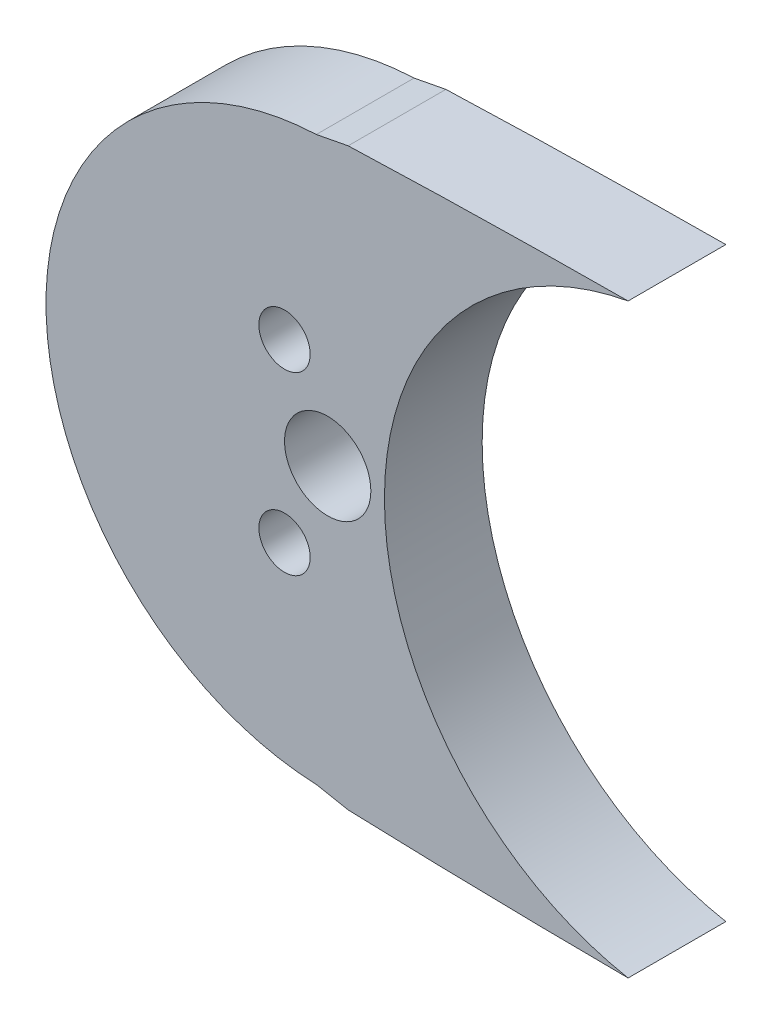
from build123d import *

# Parameters (mm, degrees)
BOSS_EXTRUDE5_START = 4.25
BOSS_EXTRUDE5_DEPTH = 6
CUT_EXTRUDE2_DEPTH  = 92.979276087
SKETCH4_R           = 1.575
CUT_EXTRUDE3_DEPTH  = 10


with BuildPart() as part:
    # Sketch2 → Boss-Extrude5 (new body)
    with BuildSketch(Plane.XY.offset(BOSS_EXTRUDE5_START)):
        with BuildLine():
            ThreePointArc((68.209851787, 17.593254842), (67.854853617, 17.589672886), (67.5, 17.578928476))
            ThreePointArc((67.5, 17.578928476), (61.469163108, 16.250714817), (56.268821721, 12.920310248))
            ThreePointArc((56.268821721, 12.920310248), (61.039234507, 7.227490774), (62.750493933, 0))
            Line((62.750493933, 0), (65.559851787, 0))
            ThreePointArc((65.559851787, 0), (66.336018817, 1.87383297), (68.209851787, 2.65))
            Line((68.209851787, 2.65), (68.209851787, 17.593254842))
        make_face()
        with BuildLine():
            ThreePointArc((56.268821721, -12.920310248), (61.469163108, -16.250714817), (67.5, -17.578928476))
            ThreePointArc((67.5, -17.578928476), (67.854853617, -17.589672886), (68.209851787, -17.593254842))
            Line((68.209851787, -17.593254842), (68.209851787, -2.65))
            ThreePointArc((68.209851787, -2.65), (66.336018817, -1.87383297), (65.559851787, 0))
            Line((65.559851787, 0), (62.750493933, 0))
            ThreePointArc((62.750493933, 0), (61.039234507, -7.227490774), (56.268821721, -12.920310248))
        make_face()
        with BuildLine():
            ThreePointArc((62.750493933, 0), (61.039234507, 7.227490774), (56.268821721, 12.920310248))
            ThreePointArc((56.268821721, 12.920310248), (52.091474062, 7.051277576), (50.616596945, 0))
            Line((50.616596945, 0), (62.750493933, 0))
        make_face()
        with BuildLine():
            ThreePointArc((50.616596945, 0), (52.091474062, -7.051277576), (56.268821721, -12.920310248))
            ThreePointArc((56.268821721, -12.920310248), (61.039234507, -7.227490774), (62.750493933, 0))
            Line((62.750493933, 0), (50.616596945, 0))
        make_face()
        with BuildLine():
            ThreePointArc((62.750493933, 0), (61.039234507, 7.227490774), (56.268821721, 12.920310248))
            ThreePointArc((56.268821721, 12.920310248), (52.091474062, 7.051277576), (50.616596945, 0))
            Line((50.616596945, 0), (62.750493933, 0))
        make_face()
        with BuildLine():
            ThreePointArc((50.616596945, 0), (52.091474062, -7.051277576), (56.268821721, -12.920310248))
            ThreePointArc((56.268821721, -12.920310248), (61.039234507, -7.227490774), (62.750493933, 0))
            Line((62.750493933, 0), (50.616596945, 0))
        make_face()
        with BuildLine():
            ThreePointArc((68.209851787, 17.593254842), (67.854853617, 17.589672886), (67.5, 17.578928476))
            ThreePointArc((67.5, 17.578928476), (61.469163108, 16.250714817), (56.268821721, 12.920310248))
            ThreePointArc((56.268821721, 12.920310248), (61.039234507, 7.227490774), (62.750493933, 0))
            Line((62.750493933, 0), (65.559851787, 0))
            ThreePointArc((65.559851787, 0), (66.336018817, 1.87383297), (68.209851787, 2.65))
            Line((68.209851787, 2.65), (68.209851787, 17.593254842))
        make_face()
        with BuildLine():
            ThreePointArc((56.268821721, -12.920310248), (61.469163108, -16.250714817), (67.5, -17.578928476))
            ThreePointArc((67.5, -17.578928476), (67.854853617, -17.589672886), (68.209851787, -17.593254842))
            Line((68.209851787, -17.593254842), (68.209851787, -2.65))
            ThreePointArc((68.209851787, -2.65), (66.336018817, -1.87383297), (65.559851787, 0))
            Line((65.559851787, 0), (62.750493933, 0))
            ThreePointArc((62.750493933, 0), (61.039234507, -7.227490774), (56.268821721, -12.920310248))
        make_face()
        with BuildLine():
            ThreePointArc((78.767770494, 14.073129307), (73.774493088, 16.69003844), (68.209851787, 17.593254842))
            Line((68.209851787, 17.593254842), (68.209851787, 2.65))
            ThreePointArc((68.209851787, 2.65), (70.083684757, 1.87383297), (70.859851787, 0))
            Line((70.859851787, 0), (71.993520086, 0))
            ThreePointArc((71.993520086, 0), (73.775238341, 7.809344356), (78.767770494, 14.073129307))
        make_face()
        with BuildLine():
            Line((68.209851787, -2.65), (68.209851787, -17.593254842))
            ThreePointArc((68.209851787, -17.593254842), (73.774493088, -16.69003844), (78.767770494, -14.073129307))
            ThreePointArc((78.767770494, -14.073129307), (73.775238341, -7.809344356), (71.993520086, 0))
            Line((71.993520086, 0), (70.859851787, 0))
            ThreePointArc((70.859851787, 0), (70.083684757, -1.87383297), (68.209851787, -2.65))
        make_face()
        with BuildLine():
            ThreePointArc((78.767770494, 14.073129307), (73.774493088, 16.69003844), (68.209851787, 17.593254842))
            Line((68.209851787, 17.593254842), (68.209851787, 2.65))
            ThreePointArc((68.209851787, 2.65), (70.083684757, 1.87383297), (70.859851787, 0))
            Line((70.859851787, 0), (71.993520086, 0))
            ThreePointArc((71.993520086, 0), (73.775238341, 7.809344356), (78.767770494, 14.073129307))
        make_face()
        with BuildLine():
            Line((68.209851787, -2.65), (68.209851787, -17.593254842))
            ThreePointArc((68.209851787, -17.593254842), (73.774493088, -16.69003844), (78.767770494, -14.073129307))
            ThreePointArc((78.767770494, -14.073129307), (73.775238341, -7.809344356), (71.993520086, 0))
            Line((71.993520086, 0), (70.859851787, 0))
            ThreePointArc((70.859851787, 0), (70.083684757, -1.87383297), (68.209851787, -2.65))
        make_face()
        with BuildLine():
            add(Edge.make_bspline(
                [(90, 18.005197753), (87.300427685, 18.005389985), (81.17457593, 17.968478919), (73.674128402, 17.806885767), (68.874876564, 17.634447138), (67.5, 17.578928476)],
                knots=[0.344744853, 0.344744853, 0.344744853, 0.344744853, 0.357984483, 0.374788114, 0.381536428, 0.381536428, 0.381536428, 0.381536428], degree=3))
            ThreePointArc((67.5, 17.578928476), (67.854853617, 17.589672886), (68.209851787, 17.593254842))
            ThreePointArc((68.209851787, 17.593254842), (73.774493088, 16.69003844), (78.767770494, 14.073129307))
            ThreePointArc((78.767770494, 14.073129307), (84.049630886, 16.993984573), (90, 18.005197753))
        make_face()
        with BuildLine():
            ThreePointArc((68.209851787, -17.593254842), (67.854853617, -17.589672886), (67.5, -17.578928476))
            add(Edge.make_bspline(
                [(67.5, -17.578928476), (68.874876564, -17.634447138), (73.674128402, -17.806885767), (81.17457593, -17.968478919), (87.300427685, -18.005389985), (90, -18.005197753)],
                knots=[0.618463572, 0.618463572, 0.618463572, 0.618463572, 0.625211886, 0.642015517, 0.655255147, 0.655255147, 0.655255147, 0.655255147], degree=3))
            ThreePointArc((90, -18.005197753), (84.049630886, -16.993984573), (78.767770494, -14.073129307))
            ThreePointArc((78.767770494, -14.073129307), (73.774493088, -16.69003844), (68.209851787, -17.593254842))
        make_face()
        with BuildLine():
            add(Edge.make_bspline(
                [(90, 18.005197753), (87.300427685, 18.005389985), (81.17457593, 17.968478919), (73.674128402, 17.806885767), (68.874876564, 17.634447138), (67.5, 17.578928476)],
                knots=[0.344744853, 0.344744853, 0.344744853, 0.344744853, 0.357984483, 0.374788114, 0.381536428, 0.381536428, 0.381536428, 0.381536428], degree=3))
            ThreePointArc((67.5, 17.578928476), (67.854853617, 17.589672886), (68.209851787, 17.593254842))
            ThreePointArc((68.209851787, 17.593254842), (73.774493088, 16.69003844), (78.767770494, 14.073129307))
            ThreePointArc((78.767770494, 14.073129307), (84.049630886, 16.993984573), (90, 18.005197753))
        make_face()
        with BuildLine():
            ThreePointArc((68.209851787, -17.593254842), (67.854853617, -17.589672886), (67.5, -17.578928476))
            add(Edge.make_bspline(
                [(67.5, -17.578928476), (68.874876564, -17.634447138), (73.674128402, -17.806885767), (81.17457593, -17.968478919), (87.300427685, -18.005389985), (90, -18.005197753)],
                knots=[0.618463572, 0.618463572, 0.618463572, 0.618463572, 0.625211886, 0.642015517, 0.655255147, 0.655255147, 0.655255147, 0.655255147], degree=3))
            ThreePointArc((90, -18.005197753), (84.049630886, -16.993984573), (78.767770494, -14.073129307))
            ThreePointArc((78.767770494, -14.073129307), (73.774493088, -16.69003844), (68.209851787, -17.593254842))
        make_face()
    extrude(amount=BOSS_EXTRUDE5_DEPTH)

    # Sketch3 → Cut-Extrude2 (cut, through all)
    with BuildSketch(Plane.XY.offset(10.25)):
        with BuildLine():
            ThreePointArc((67.512104385, -17.279172769), (50.916596945, 0), (67.512104385, 17.279172769))
            Line((67.512104385, 17.279172769), (69.466542011, 17.654214769))
            add(Edge.make_bspline(
                [(69.466542011, 17.654214769), (68.810976965, 17.630475848), (68.155460296, 17.605396509), (67.5, 17.578928476)],
                knots=[0.378319229, 0.378319229, 0.378319229, 0.378319229, 0.381536428, 0.381536428, 0.381536428, 0.381536428], degree=3))
            ThreePointArc((67.5, 17.578928476), (50.616596945, 0), (67.5, -17.578928476))
            add(Edge.make_bspline(
                [(67.5, -17.578928476), (68.155460296, -17.605396509), (68.810976965, -17.630475848), (69.466542011, -17.654214769)],
                knots=[0.618463572, 0.618463572, 0.618463572, 0.618463572, 0.621680771, 0.621680771, 0.621680771, 0.621680771], degree=3))
            Line((69.466542011, -17.654214769), (67.512104385, -17.279172769))
        make_face()
        with BuildLine():
            add(Edge.make_bspline(
                [(90, 18.005197753), (88.88435893, 18.005277196), (87.768717531, 18.00254573), (86.653091523, 17.996862246)],
                knots=[0.344744853, 0.344744853, 0.344744853, 0.344744853, 0.35021634, 0.35021634, 0.35021634, 0.35021634], degree=3))
            ThreePointArc((86.653091523, 17.996862246), (71.693520086, 0), (86.653091523, -17.996862246))
            add(Edge.make_bspline(
                [(86.653091523, -17.996862246), (87.768717531, -18.00254573), (88.88435893, -18.005277196), (90, -18.005197753)],
                knots=[0.64978366, 0.64978366, 0.64978366, 0.64978366, 0.655255147, 0.655255147, 0.655255147, 0.655255147], degree=3))
            ThreePointArc((90, -18.005197753), (71.993520086, 0), (90, 18.005197753))
        make_face()
    extrude(amount=-CUT_EXTRUDE2_DEPTH, mode=Mode.SUBTRACT)

    # Sketch4 → Cut-Extrude3 (cut)
    with BuildSketch(Plane.XY.offset(10.25)):
        with Locations((65.559851787, 5.4)):
            Circle(SKETCH4_R)
        with Locations((65.559851787, -5.4)):
            Circle(SKETCH4_R)
    extrude(amount=-CUT_EXTRUDE3_DEPTH, mode=Mode.SUBTRACT)


solid = part.part
